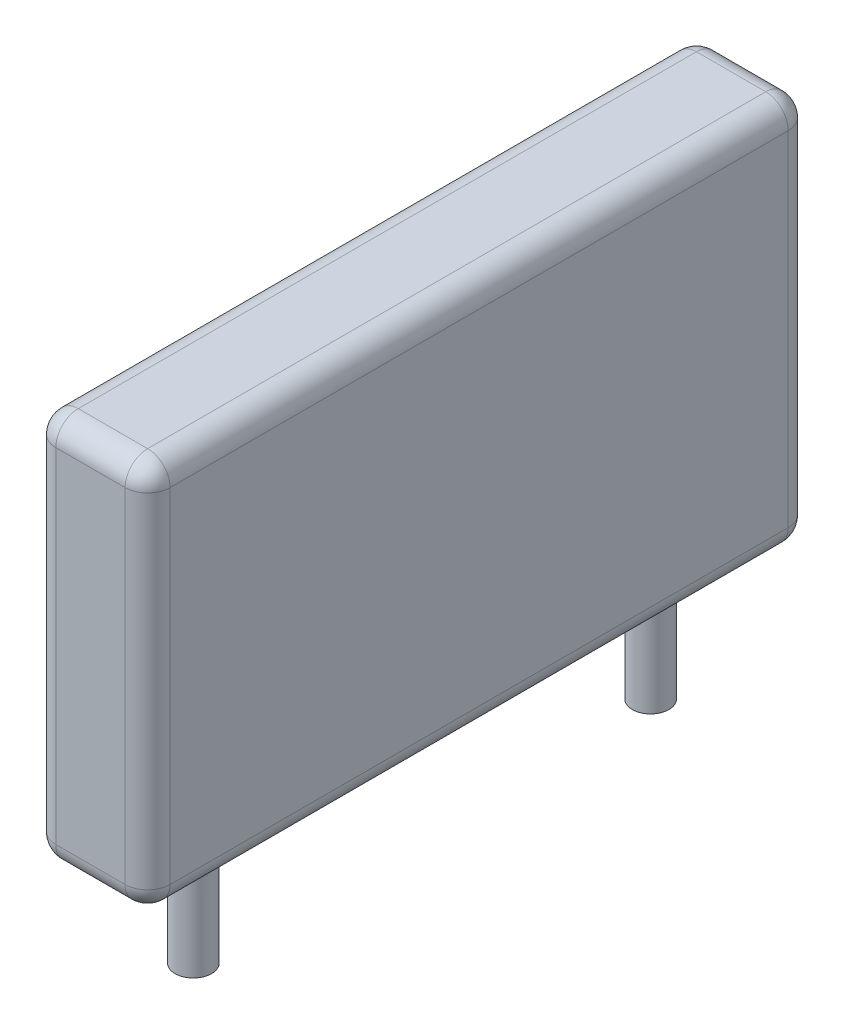
from build123d import *

# Parameters (mm, degrees)
SKETCH1_W           = 14.732
SKETCH1_H           = 8.636
BOSS_EXTRUDE1_DEPTH = 1.27
SKETCH2_R           = 0.4064
BOSS_EXTRUDE2_DEPTH = 2.54
FILLET1_R           = 0.5


with BuildPart() as part:
    # Sketch1 → Boss-Extrude1 (new, symmetric)
    with BuildSketch(Plane(origin=(0, 0, 0), x_dir=(0, 0, -1), z_dir=(1, 0, 0))):
        Rectangle(SKETCH1_W, SKETCH1_H)
    extrude(amount=BOSS_EXTRUDE1_DEPTH, both=True)

    # Sketch2 → Boss-Extrude2 (add)
    with BuildSketch(Plane.XZ.offset(4.318)):
        with Locations(Location((0, 5.08, 0), (0, 0, 90))):
            Circle(SKETCH2_R)
    boss_extrude2 = extrude(amount=BOSS_EXTRUDE2_DEPTH)

    # Mirror1: Boss-Extrude2 across plane
    add(boss_extrude2.mirror(Plane.XY))

    # Fillet1
    fillet1_edges = [part.edges().sort_by_distance(p)[0] for p in [
        (1.27, 0, 7.366),
        (1.27, -4.318, 0),
        (1.27, 0, -7.366),
        (-1.27, -4.318, 0),
        (-1.27, 0, 7.366),
        (-1.27, 4.318, 0),
        (-1.27, 0, -7.366),
        (0, -4.318, -7.366),
        (0, -4.318, 7.366),
        (0, 4.318, 7.366),
        (0, 4.318, -7.366),
        (1.27, 4.318, 0),
    ]]
    fillet(fillet1_edges, radius=FILLET1_R)


solid = part.part
